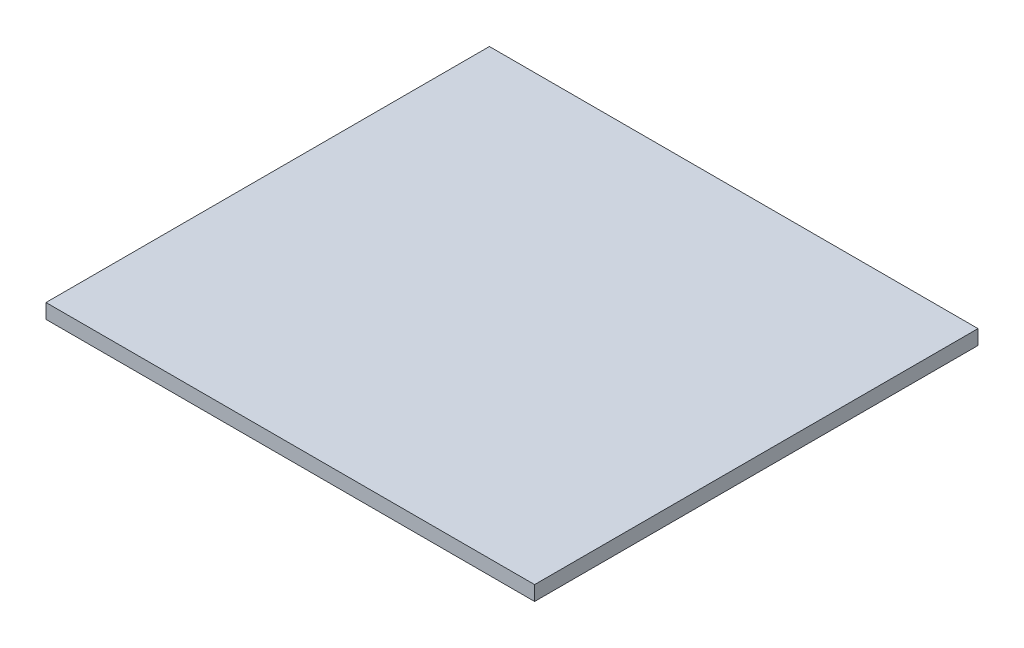
from build123d import *

# Parameters (mm, degrees)
CROQUIS1_W              = 400
CROQUIS1_H              = 363
SALIENTE_EXTRUIR1_DEPTH = 12


with BuildPart() as part:
    # Croquis1 → Saliente-Extruir1 (new body)
    with BuildSketch(Plane(origin=(0, 0, 0), x_dir=(1, 0, 0), z_dir=(0, 1, 0))):
        with Locations((-22.69416696, -82.865187713)):
            Rectangle(CROQUIS1_W, CROQUIS1_H)
    extrude(amount=SALIENTE_EXTRUIR1_DEPTH)


solid = part.part
